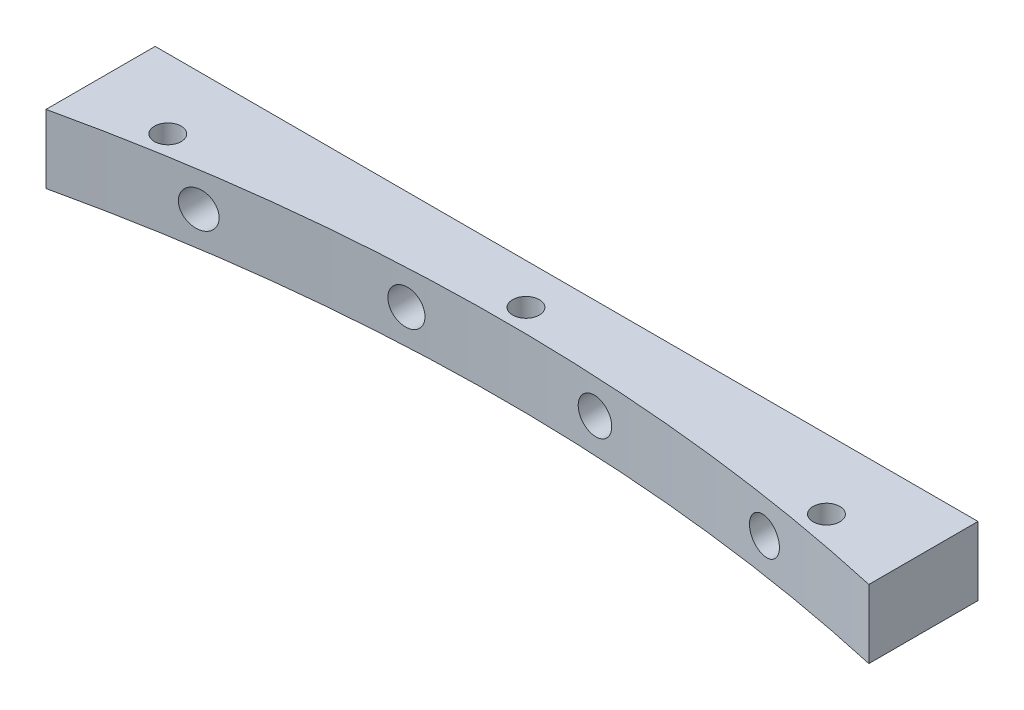
from build123d import *

# Parameters (mm, degrees)
BOSS_EXTRUDE1_DEPTH                = 25.4
F_25_64_0_39063_DIAMETER_HOLE1_D   = 9.922002
CIRPATTERN4_COUNT                  = 36
TAPPED_HOLE_FOR_1_2_13_HELICOIL1_D = 13.09624
LPATTERN1_COUNT                    = 4
LPATTERN1_PITCH                    = 69.85


with BuildPart() as part:
    # Sketch1 → Boss-Extrude1 (new body)
    with BuildSketch(Plane(origin=(0, 0, 0), x_dir=(1, 0, 0), z_dir=(0, 1, 0))):
        with BuildLine():
            Line((-152.4, 677.116373325), (-152.4, 717.55))
            Line((-152.4, 717.55), (152.4, 717.55))
            Line((152.4, 717.55), (152.4, 677.116373325))
            ThreePointArc((152.4, 677.116373325), (0, 694.055), (-152.4, 677.116373325))
        make_face()
    extrude(amount=BOSS_EXTRUDE1_DEPTH)

    # 25/64 (0.39063) Diameter Hole1 (through all)
    with Locations(Plane(origin=(0, 25.4, 0), x_dir=(1, 0, 0), z_dir=(0, 1, 0))):
        with Locations((0, 702.5)):
            f_25_64_0_39063_diameter_hole1 = Hole(F_25_64_0_39063_DIAMETER_HOLE1_D / 2)

    # CirPattern4: 25/64 (0.39063) Diameter Hole1 ×36 about axis, 33 skipped
    cirpattern4_axis = Axis((0, 0, 0), (0, -1, 0))
    add([f_25_64_0_39063_diameter_hole1.rotate(cirpattern4_axis, i * 360 / CIRPATTERN4_COUNT) for i in range(1, CIRPATTERN4_COUNT) if i not in (2, 3, 4, 5, 6, 7, 8, 9, 10, 11, 12, 13, 14, 15, 16, 17, 18, 19, 20, 21, 22, 23, 24, 25, 26, 27, 28, 29, 30, 31, 32, 33, 34)], mode=Mode.SUBTRACT)

    # Tapped Hole for 1/2-13 Helicoil1 (through all)
    with Locations(Plane(origin=(0, 0, -717.55), x_dir=(-1, 0, 0), z_dir=(0, 0, -1))):
        with Locations((-104.775, 12.7)):
            tapped_hole_for_1_2_13_helicoil1 = Hole(TAPPED_HOLE_FOR_1_2_13_HELICOIL1_D / 2)

    # LPattern1: Tapped Hole for 1/2-13 Helicoil1 ×4
    with Locations(*[(-i * LPATTERN1_PITCH, 0, 0) for i in range(1, LPATTERN1_COUNT)]):
        add(tapped_hole_for_1_2_13_helicoil1, mode=Mode.SUBTRACT)


solid = part.part
